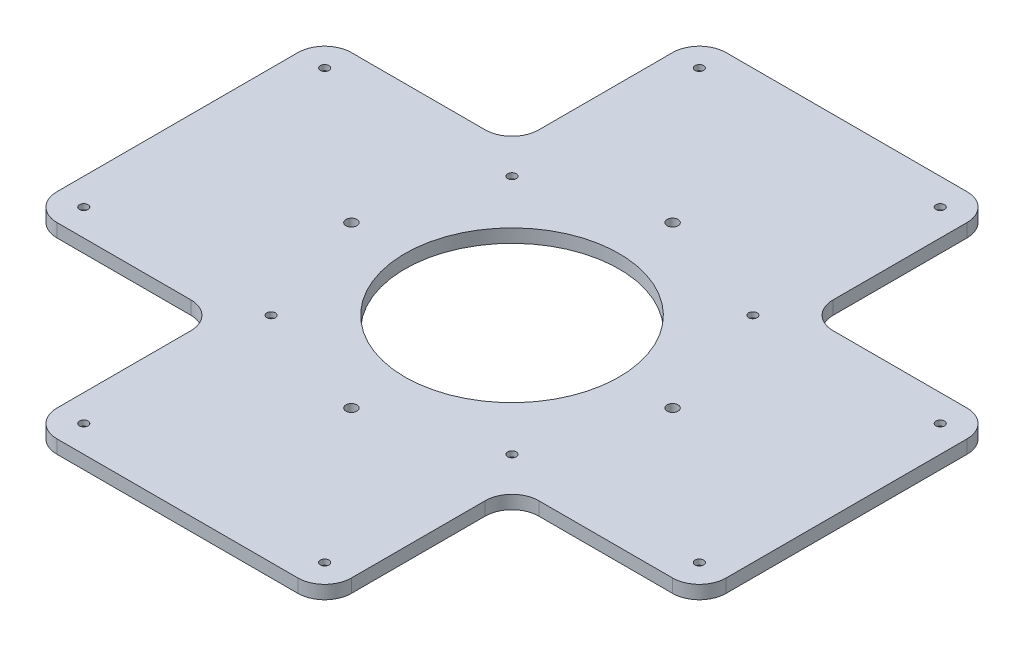
from build123d import *

# Parameters (mm, degrees)
SKETCH_1_W          = 250
SKETCH_1_H          = 250
SKETCH_1_R          = 40
SKETCH_1_R_2        = 2.05
EXTRUDE_1_DEPTH     = 5
SKETCH_2_R          = 1.6
SKETCH_2_W          = 70
SKETCH_2_H          = 70
CUT_EXTRUDE_1_DEPTH = 177.847391838
FILLET_1_R          = 10
SKETCH_4_R          = 3
CUT_EXTRUDE_3_DEPTH = 3


with BuildPart() as part:
    # ｽｹｯﾁ1 → ﾎﾞｽ - 押し出し1 (new body)
    with BuildSketch(Plane(origin=(0, 0, 0), x_dir=(1, 0, 0), z_dir=(0, 1, 0))):
        Rectangle(SKETCH_1_W, SKETCH_1_H)
        with Locations(Location((0, 0, 0), (0, 0, 270))):
            Circle(SKETCH_1_R, mode=Mode.SUBTRACT)
        with Locations(Location((0, 60, 0), (0, 0, 270))):
            Circle(SKETCH_1_R_2, mode=Mode.SUBTRACT)
        with Locations(Location((60, 0, 0), (0, 0, 270))):
            Circle(SKETCH_1_R_2, mode=Mode.SUBTRACT)
        with Locations(Location((0, -60, 0), (0, 0, 270))):
            Circle(SKETCH_1_R_2, mode=Mode.SUBTRACT)
        with Locations(Location((-60, 0, 0), (0, 0, 270))):
            Circle(SKETCH_1_R_2, mode=Mode.SUBTRACT)
    extrude(amount=EXTRUDE_1_DEPTH)

    # ｽｹｯﾁ2 → ｶｯﾄ - 押し出し1 (cut, through all)
    with BuildSketch(Plane(origin=(0, 5, 0), x_dir=(1, 0, 0), z_dir=(0, 1, 0))):
        with Locations(Location((-45, 115, 0), (0, 0, 270))):
            Circle(SKETCH_2_R)
        with Locations(Location((-45, 45, 0), (0, 0, 270))):
            Circle(SKETCH_2_R)
        with Locations(Location((-115, 45, 0), (0, 0, 270))):
            Circle(SKETCH_2_R)
        with Locations(Location((115, 45, 0), (0, 0, 90))):
            Circle(SKETCH_2_R)
        with Locations(Location((45, 115, 0), (0, 0, 90))):
            Circle(SKETCH_2_R)
        with Locations(Location((45, 45, 0), (0, 0, 90))):
            Circle(SKETCH_2_R)
        with Locations(Location((-115, -45, 0), (0, 0, 90))):
            Circle(SKETCH_2_R)
        with Locations(Location((-45, -45, 0), (0, 0, 90))):
            Circle(SKETCH_2_R)
        with Locations(Location((-45, -115, 0), (0, 0, 90))):
            Circle(SKETCH_2_R)
        with Locations(Location((45, -115, 0), (0, 0, 270))):
            Circle(SKETCH_2_R)
        with Locations(Location((45, -45, 0), (0, 0, 270))):
            Circle(SKETCH_2_R)
        with Locations(Location((115, -45, 0), (0, 0, 270))):
            Circle(SKETCH_2_R)
        with Locations((-90, 90)):
            Rectangle(SKETCH_2_W, SKETCH_2_H)
        with Locations((90, 90)):
            Rectangle(SKETCH_2_W, SKETCH_2_H)
        with Locations((90, -90)):
            Rectangle(SKETCH_2_W, SKETCH_2_H)
        with Locations((-90, -90)):
            Rectangle(SKETCH_2_W, SKETCH_2_H)
    extrude(amount=-CUT_EXTRUDE_1_DEPTH, mode=Mode.SUBTRACT)

    # ﾌｨﾚｯﾄ1
    fillet_1_edges = [part.edges().sort_by_distance(p)[0] for p in [
        (-125, 2.5, -55),
        (-55, 2.5, -125),
        (-55, 2.5, -55),
        (-125, 2.5, 55),
        (-55, 2.5, 55),
        (-55, 2.5, 125),
        (55, 2.5, 125),
        (55, 2.5, 55),
        (125, 2.5, 55),
        (125, 2.5, -55),
        (55, 2.5, -55),
        (55, 2.5, -125),
    ]]
    fillet(fillet_1_edges, radius=FILLET_1_R)

    # ｽｹｯﾁ4 → ｶｯﾄ - 押し出し3 (cut)
    with BuildSketch(Plane.XZ):
        with Locations(Location((-45, 115, 0), (0, 0, 270))):
            Circle(SKETCH_4_R)
        with Locations(Location((-45, 45, 0), (0, 0, 270))):
            Circle(SKETCH_4_R)
        with Locations(Location((-115, 45, 0), (0, 0, 270))):
            Circle(SKETCH_4_R)
        with Locations(Location((115, 45, 0), (0, 0, 90))):
            Circle(SKETCH_4_R)
        with Locations(Location((45, 45, 0), (0, 0, 90))):
            Circle(SKETCH_4_R)
        with Locations(Location((45, 115, 0), (0, 0, 90))):
            Circle(SKETCH_4_R)
        with Locations(Location((45, -115, 0), (0, 0, 270))):
            Circle(SKETCH_4_R)
        with Locations(Location((45, -45, 0), (0, 0, 270))):
            Circle(SKETCH_4_R)
        with Locations(Location((115, -45, 0), (0, 0, 270))):
            Circle(SKETCH_4_R)
        with Locations(Location((-115, -45, 0), (0, 0, 90))):
            Circle(SKETCH_4_R)
        with Locations(Location((-45, -45, 0), (0, 0, 90))):
            Circle(SKETCH_4_R)
        with Locations(Location((-45, -115, 0), (0, 0, 90))):
            Circle(SKETCH_4_R)
    extrude(amount=-CUT_EXTRUDE_3_DEPTH, mode=Mode.SUBTRACT)


solid = part.part
